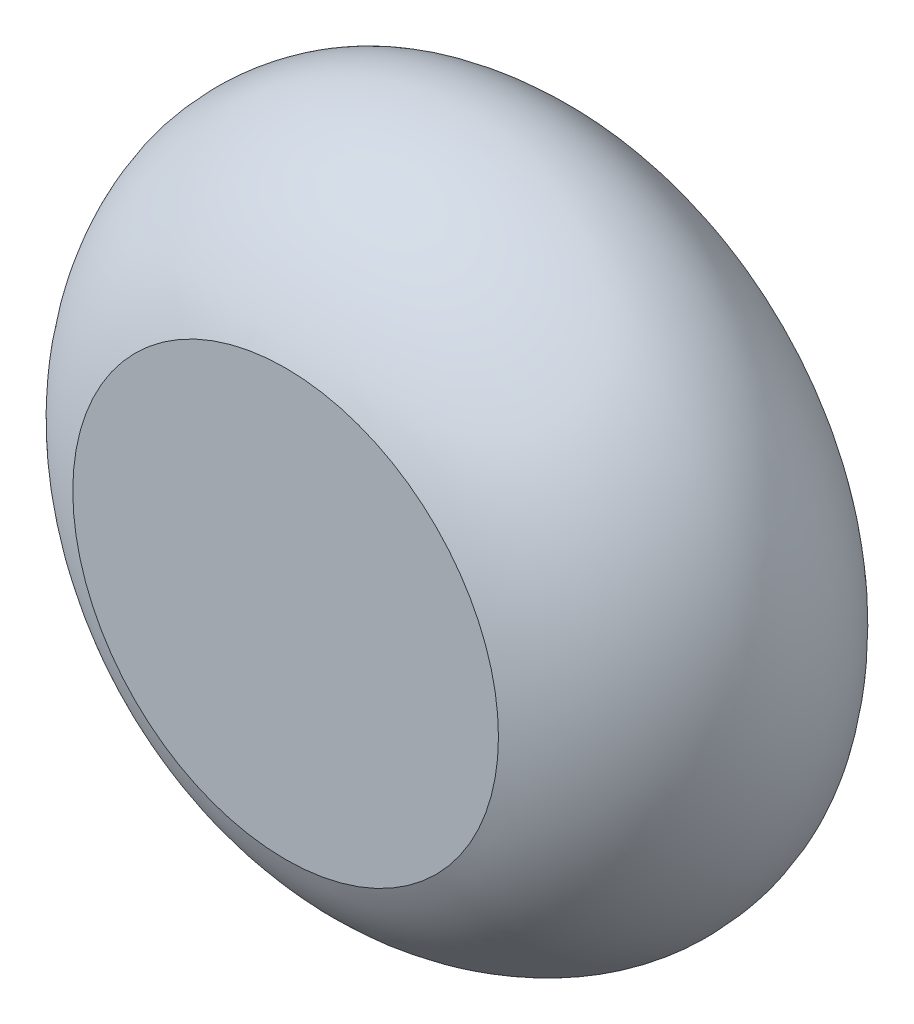
from build123d import *


with BuildPart() as part:
    # Sketch1 → Revolve1 (revolve)
    with BuildSketch(Plane(origin=(0, 0, 0), x_dir=(1, 0, 0), z_dir=(0, 1, 0))):
        with BuildLine():
            Line((-30.744323303, -6.524254843), (1.775972848, -6.524254843))
            Line((1.775972848, -6.524254843), (1.775972848, -11.524254843))
            Line((1.775972848, -11.524254843), (-31.750727026, -11.524254843))
            add(Edge.make_bspline(
                [(-23.491276538, 42.391108449), (-24.166685522, 42.276446733), (-25.496572315, 42.043181111), (-28.303803676, 41.49291465), (-31.933025512, 40.618354153), (-35.654645554, 39.33640347), (-38.612268311, 37.957757219), (-40.794900393, 36.718900422), (-42.92064777, 35.244368576), (-44.91983386, 33.525935008), (-46.647769795, 31.746744316), (-48.147713752, 30.002446508), (-49.680424918, 27.910450053), (-51.065536918, 25.438814114), (-52.138108372, 22.510490308), (-52.7280217, 19.54010512), (-52.952833493, 16.570486758), (-52.80920372, 13.600510598), (-52.297850634, 10.828994665), (-51.514876958, 8.31246372), (-50.585354355, 6.084413562), (-49.167887177, 3.24452201), (-46.974454441, -0.183259964), (-43.746963036, -3.904900755), (-40.631238994, -6.586886133), (-37.947298053, -8.431934146), (-36.202837821, -9.454657901), (-34.780775393, -10.189934255), (-33.872903735, -10.618654817), (-33.249671023, -10.893869064), (-32.865963207, -11.056612449), (-32.438077799, -11.235538377), (-32.050748071, -11.398378164), (-31.750727026, -11.524254843)],
                knots=[0, 0, 0, 0, 0.031866055, 0.06373211, 0.127464221, 0.191196331, 0.223062386, 0.254928441, 0.286794497, 0.318660552, 0.350526607, 0.382392662, 0.414258717, 0.446124772, 0.477990828, 0.509856883, 0.541722938, 0.573588993, 0.605455048, 0.637321103, 0.669187159, 0.701053214, 0.764785324, 0.828517434, 0.892249545, 0.9241156, 0.955981655, 0.971914683, 0.98784771, 0.995814224, 0.999797481, 1.003780738, 1.019713765, 1.019713765, 1.019713765, 1.019713765], degree=3))
            ThreePointArc((-23.491276538, 42.391108449), (-22.990193071, 42.469745446), (-22.487046921, 42.533873199))
            Line((-22.487046921, 42.533873199), (-22.654418523, 37.461639039))
            add(Edge.make_bspline(
                [(-22.654418523, 37.461639039), (-23.293586457, 37.353129834), (-24.562008978, 37.130698031), (-27.159691982, 36.622597003), (-31.735042085, 35.524850055), (-36.19495858, 33.772704978), (-39.6153206, 31.463637674), (-41.225069166, 30.124338931), (-42.696057225, 28.653414198), (-44.440622687, 26.663727132), (-46.012750087, 24.444333916), (-47.132957506, 21.729847985), (-47.846011724, 18.724560099), (-48.032237042, 14.75254363), (-47.117667394, 10.604259312), (-45.526704043, 6.973440434), (-43.430503068, 3.477508081), (-40.817650905, 0.284125878), (-37.767935946, -2.515426362), (-34.943416372, -4.444027784), (-32.56306645, -5.728449777), (-31.356620217, -6.267359858), (-30.744323303, -6.524254843)],
                knots=[0, 0, 0, 0, 0.031352676, 0.062705352, 0.125410703, 0.250821407, 0.282174083, 0.313526759, 0.344879434, 0.37623211, 0.438937462, 0.470290138, 0.501642814, 0.564348166, 0.627053517, 0.689758869, 0.752464221, 0.815169572, 0.877874924, 0.940580276, 0.971932952, 1.003285628, 1.003285628, 1.003285628, 1.003285628], degree=3))
        make_face()
    revolve(axis=Axis((1.775972848, 0, -37.461639039), (0, 0, 1)))


solid = part.part
